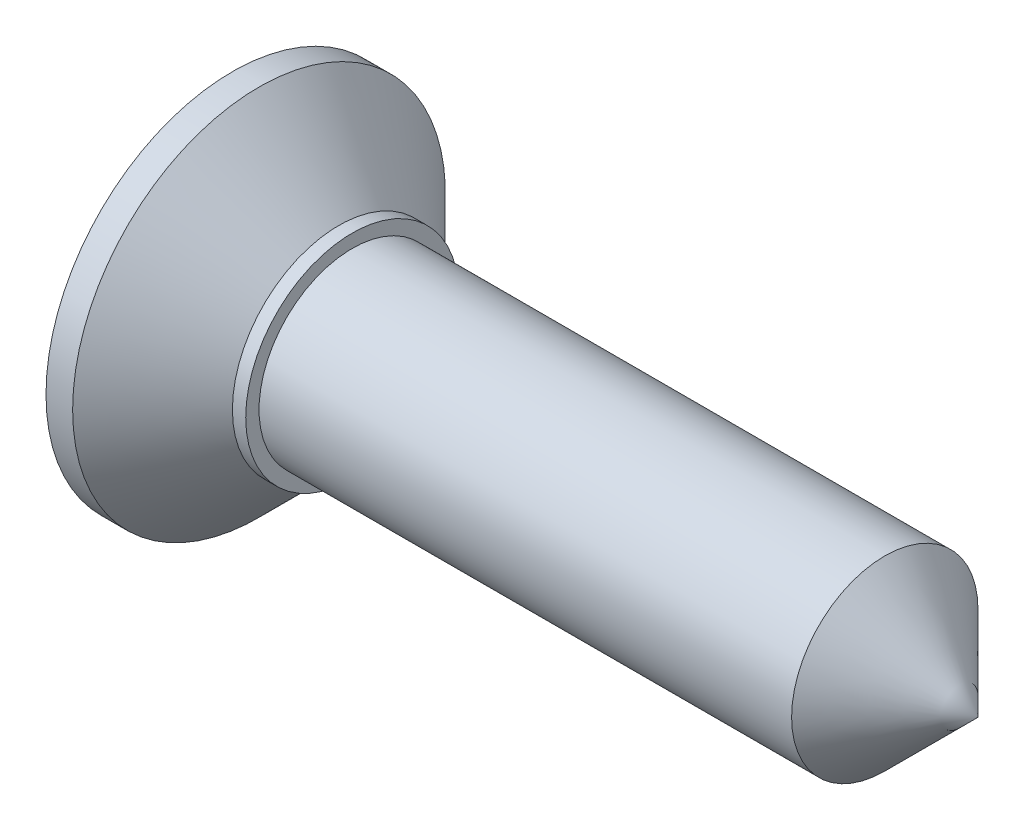
from build123d import *

# Parameters (mm, degrees)
SKETCH2_R           = 1.75
BOSS_EXTRUDE1_DEPTH = 10
CUT_EXTRUDE1_DEPTH  = 1
DRAFT1_ANGLE        = -40
DRAFT2_ANGLE        = -40
DRAFT3_ANGLE        = -40
DRAFT4_ANGLE        = -40
DRAFT5_ANGLE        = -40
DRAFT6_ANGLE        = -40
DRAFT7_ANGLE        = -40
DRAFT8_ANGLE        = -40


with BuildPart() as part:
    # Sketch1 → Revolve1 (revolve)
    with BuildSketch(Plane(origin=(0, 0, 0), x_dir=(-1, 0, 0), z_dir=(0, 0, -1)), mode=Mode.PRIVATE) as revolve1_sk:
        Polygon((-2.25, 2), (-2.25, 0), (0, 0), (0, 3.5), (-0.5, 3.5), (-2, 2), align=None)
    revolve(revolve1_sk.sketch.rotate(Axis((2.25, 0, 0), (-1, 0, 0)), 270), axis=Axis((2.25, 0, 0), (-1, 0, 0)))

    # Sketch2 → Boss-Extrude1 (add)
    with BuildSketch(Plane(origin=(2.25, 0, 0), x_dir=(0, 0, -1), z_dir=(1, 0, 0))):
        Circle(SKETCH2_R)
    extrude(amount=BOSS_EXTRUDE1_DEPTH)

    # Sketch3 → Revolve2 (revolve)
    with BuildSketch(Plane.XY, mode=Mode.PRIVATE) as revolve2_sk:
        Polygon((12.25, 1.75), (12.25, 0), (14, 0), align=None)
    revolve(revolve2_sk.sketch.rotate(Axis((14.949975, 0, 0), (1, 0, 0)), 90), axis=Axis((14.949975, 0, 0), (1, 0, 0)))

    # Sketch4 → Cut-Extrude1 (cut)
    with BuildSketch(Plane.ZY):
        Polygon((-0.605426386, -0.43), (-0.605426386, -0.605426386), (-0.43, -0.605426386), (-0.43, -2.15), (0.43, -2.15), (0.43, -0.605426386), (0.605426386, -0.605426386), (0.605426386, -0.43), (2.15, -0.43), (2.15, 0.43), (0.605426386, 0.43), (0.605426386, 0.605426386), (0.43, 0.605426386), (0.43, 2.15), (-0.43, 2.15), (-0.43, 0.605426386), (-0.605426386, 0.605426386), (-0.605426386, 0.43), (-2.15, 0.43), (-2.15, -0.43), align=None)
    extrude(amount=-CUT_EXTRUDE1_DEPTH, mode=Mode.SUBTRACT)

    # Draft1
    draft1_faces = [part.faces().sort_by_distance(p)[0] for p in [
        (0.5, -0.605426386, -0.517713193),
    ]]
    draft(draft1_faces, Plane(origin=(1, -0.605426386, -0.43), x_dir=(0, 1, 0), z_dir=(0, 0, 1)), DRAFT1_ANGLE)

    # Draft2
    draft2_faces = [part.faces().sort_by_distance(p)[0] for p in [
        (0.5, -0.605426386, 0.517713193),
    ]]
    draft(draft2_faces, Plane(origin=(1, -2.15, 0.43), x_dir=(0, -1, 0), z_dir=(0, 0, -1)), DRAFT2_ANGLE)

    # Draft3
    draft3_faces = [part.faces().sort_by_distance(p)[0] for p in [
        (0.5, -0.591313301, 0.605426386),
    ]]
    draft(draft3_faces, Plane(origin=(1, -0.43, 0.605426386), x_dir=(0, 0, 1), z_dir=(0, 1, 0)), DRAFT3_ANGLE)

    # Draft4
    draft4_faces = [part.faces().sort_by_distance(p)[0] for p in [
        (0.5, 0.517713193, 0.605426386),
    ]]
    draft(draft4_faces, Plane(origin=(1, 0.43, 2.15), x_dir=(0, 0, -1), z_dir=(0, -1, 0)), DRAFT4_ANGLE)

    # Draft5
    draft5_faces = [part.faces().sort_by_distance(p)[0] for p in [
        (0.5, 0.605426386, 0.591313301),
    ]]
    draft(draft5_faces, Plane(origin=(1, 0.605426386, 0.43), x_dir=(0, -1, 0), z_dir=(0, 0, -1)), DRAFT5_ANGLE)

    # Draft6
    draft6_faces = [part.faces().sort_by_distance(p)[0] for p in [
        (0.5, 0.605426386, -0.517713193),
    ]]
    draft(draft6_faces, Plane(origin=(1, 2.15, -0.43), x_dir=(0, 1, 0), z_dir=(0, 0, 1)), DRAFT6_ANGLE)

    # Draft7
    draft7_faces = [part.faces().sort_by_distance(p)[0] for p in [
        (0.5, 0.591313301, -0.605426386),
    ]]
    draft(draft7_faces, Plane(origin=(1, 0.43, -0.605426386), x_dir=(0, 0, -1), z_dir=(0, -1, 0)), DRAFT7_ANGLE)

    # Draft8
    draft8_faces = [part.faces().sort_by_distance(p)[0] for p in [
        (0.5, -0.591313301, -0.605426386),
    ]]
    draft(draft8_faces, Plane(origin=(1, -0.43, -2.15), x_dir=(0, 0, 1), z_dir=(0, 1, 0)), DRAFT8_ANGLE)


solid = part.part
